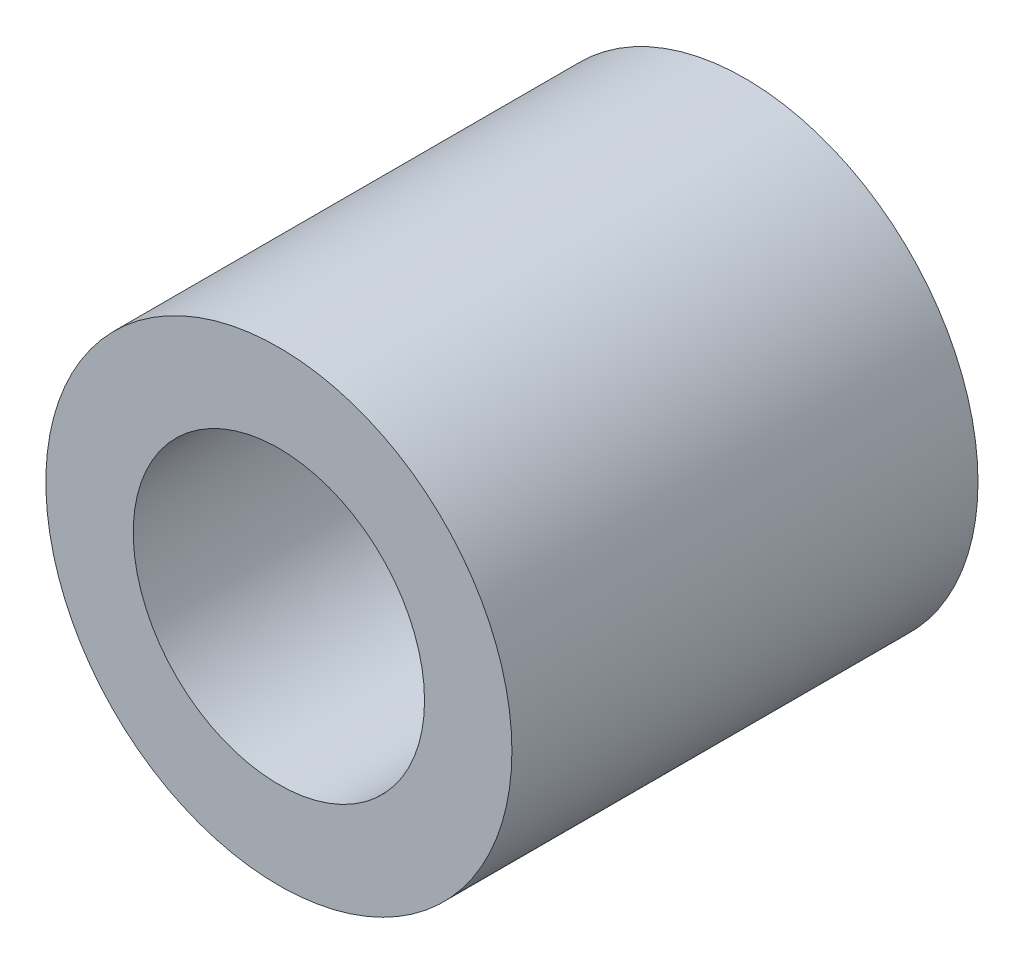
from build123d import *

# Parameters (mm, degrees)
SKETCH1_R           = 8
SKETCH1_R_2         = 5
BOSS_EXTRUDE1_DEPTH = 8


with BuildPart() as part:
    # Sketch1 → Boss-Extrude1 (new, symmetric)
    with BuildSketch(Plane.XY):
        Circle(SKETCH1_R)
        Circle(SKETCH1_R_2, mode=Mode.SUBTRACT)
    extrude(amount=BOSS_EXTRUDE1_DEPTH, both=True)


solid = part.part
